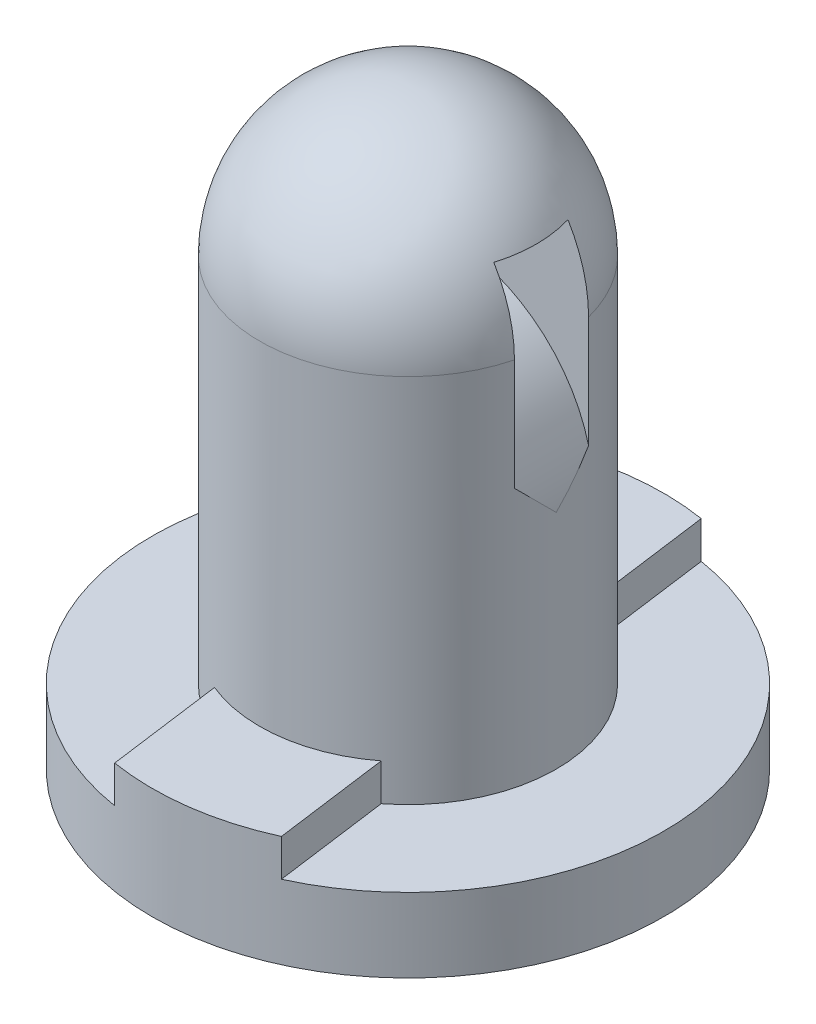
from build123d import *

# Parameters (mm, degrees)
SKETCH2_R           = 3.45
BOSS_EXTRUDE1_DEPTH = 1
SKETCH4_R           = 2
BOSS_EXTRUDE2_DEPTH = 5
CUT_EXTRUDE1_DEPTH  = 0.5
BOSS_EXTRUDE3_DEPTH = 0.5


with BuildPart() as part:
    # Sketch2 → Boss-Extrude1 (new body)
    with BuildSketch(Plane(origin=(0, 0, 0), x_dir=(1, 0, 0), z_dir=(0, 1, 0))):
        with Locations(Location((0, 0, 0), (0, 0, 270))):
            Circle(SKETCH2_R)
    extrude(amount=BOSS_EXTRUDE1_DEPTH)

    # Sketch4 → Boss-Extrude2 (add)
    with BuildSketch(Plane(origin=(0, 1, 0), x_dir=(1, 0, 0), z_dir=(0, 1, 0))):
        with Locations(Location((0, 0, 0), (0, 0, 270))):
            Circle(SKETCH4_R)
    extrude(amount=BOSS_EXTRUDE2_DEPTH)

    # Sketch5 → Revolve1 (revolve)
    with BuildSketch(Plane(origin=(0, 0, 0), x_dir=(0, 0, -1), z_dir=(1, 0, 0)), mode=Mode.PRIVATE) as revolve1_sk:
        with BuildLine():
            Line((0, 0), (-1, 0))
            Line((-1, 0), (-2, 6))
            ThreePointArc((-2, 6), (-1.414213562, 7.414213562), (0, 8))
            Line((0, 8), (0, 0))
        make_face()
    revolve(revolve1_sk.sketch.rotate(Axis((0, 0, 0), (0, 1, 0)), 180), axis=Axis((0, 0, 0), (0, 1, 0)))

    # Sketch8 → Cut-Extrude1 (cut, symmetric)
    with BuildSketch(Plane.XY):
        with BuildLine():
            Line((-2, 4), (-2, 7))
            Line((-2, 7), (2, 7))
            Line((2, 7), (2, 4))
            ThreePointArc((2, 4), (0, 6), (-2, 4))
        make_face()
    extrude(amount=CUT_EXTRUDE1_DEPTH, both=True, mode=Mode.SUBTRACT)

    # Sketch10 → Boss-Extrude3 (add)
    with BuildSketch(Plane(origin=(0, 1, 0), x_dir=(1, 0, 0), z_dir=(0, 1, 0))):
        with BuildLine():
            Line((-1.431879851, 3.138824635), (-0.55021537, -3.405842487))
            ThreePointArc((-0.55021537, -3.405842487), (0.460605794, -3.419114257), (1.431879851, -3.138824635))
            Line((1.431879851, -3.138824635), (0.55021537, 3.405842487))
            ThreePointArc((0.55021537, 3.405842487), (-0.460605794, 3.419114257), (-1.431879851, 3.138824635))
        make_face()
    extrude(amount=BOSS_EXTRUDE3_DEPTH)


solid = part.part
